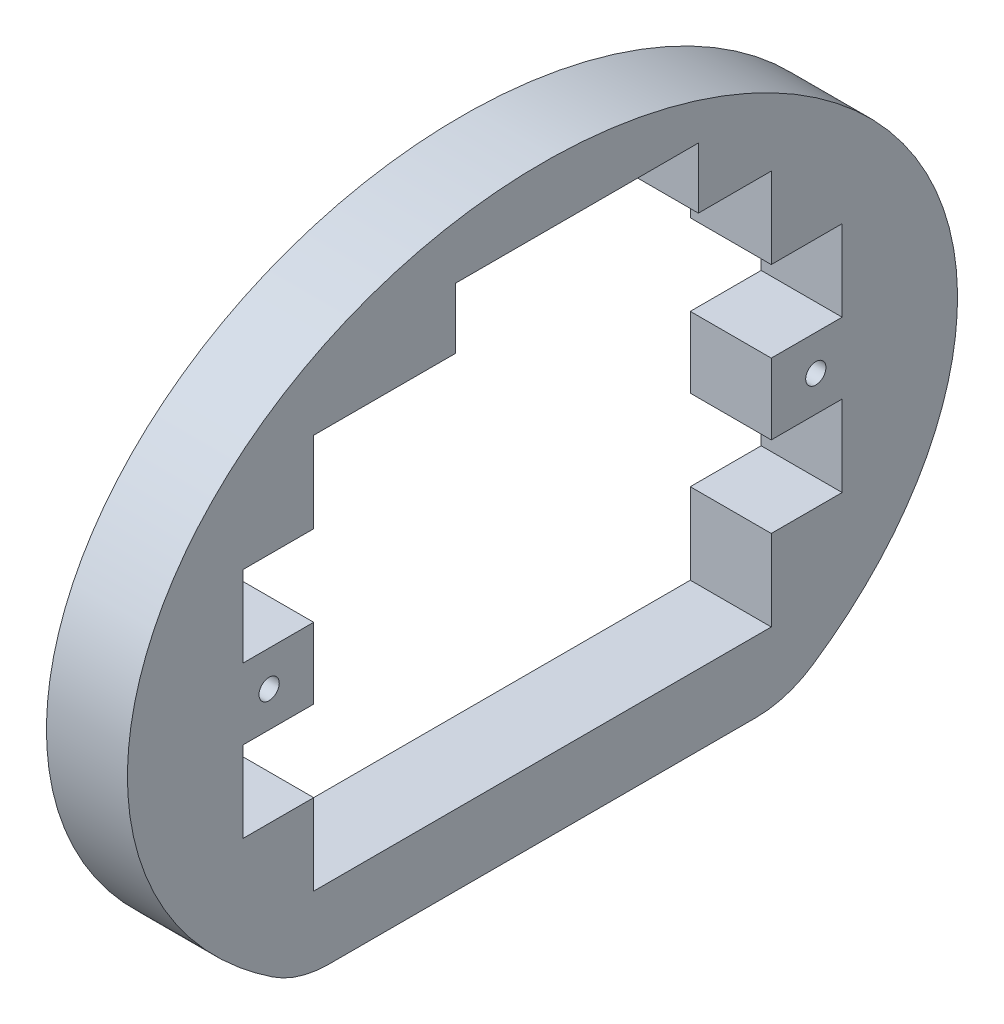
from build123d import *

# Parameters (mm, degrees)
SCHIZZO1_R                   = 0.5
ESTRUSIONE_ESTRUSIONE1_DEPTH = 4
RACCORDO1_R                  = 5


with BuildPart() as part:
    # Schizzo1 → Estrusione-Estrusione1 (new body)
    with BuildSketch(Plane(origin=(0, 0, 0), x_dir=(0, 0, -1), z_dir=(1, 0, 0))):
        with BuildLine():
            add(Edge.make_bspline(
                [(31.8, 9.5), (31.8, 35.697017779), (1.938895376, 23.734431229), (-27.922209248, 11.77184468), (-0.650704412, -3.5)],
                knots=[0, 0, 0, 2.045010246, 2.045010246, 4.090020492, 4.090020492, 4.090020492], degree=2, weights=[1, 0.521229676, 1, 0.521229676, 1]))
            Line((-0.650704412, -3.5), (23.250704412, -3.5))
            add(Edge.make_bspline(
                [(23.250704412, -3.5), (31.8, 1.28754345), (31.8, 9.5)],
                knots=[5.334757469, 5.334757469, 5.334757469, 6.283185307, 6.283185307, 6.283185307], degree=2, weights=[1, 0.889651952, 1]))
        make_face()
        with Locations((-2.2, 9.75)):
            Circle(SCHIZZO1_R, mode=Mode.SUBTRACT)
        Polygon((-3.5, 11.5), (-3.5, 15.5), (0, 15.5), (0, 19.5), (7, 19.5), (7, 22.5), (19, 22.5), (19, 19.5), (22.6, 19.5), (22.6, 15.5), (26.1, 15.5), (26.1, 11.5), (22.6, 11.5), (22.6, 8), (26.1, 8), (26.1, 4), (22.6, 4), (22.6, 0), (0, 0), (0, 4), (-3.5, 4), (-3.5, 8), (0, 8), (0, 11.5), align=None, mode=Mode.SUBTRACT)
        with Locations((24.8, 9.75)):
            Circle(SCHIZZO1_R, mode=Mode.SUBTRACT)
    extrude(amount=ESTRUSIONE_ESTRUSIONE1_DEPTH)

    # Raccordo1
    raccordo1_edges = [part.edges().sort_by_distance(p)[0] for p in [
        (2, -3.5, 0.650704412),
        (2, -3.5, -23.250704412),
    ]]
    fillet(raccordo1_edges, radius=RACCORDO1_R)


solid = part.part
